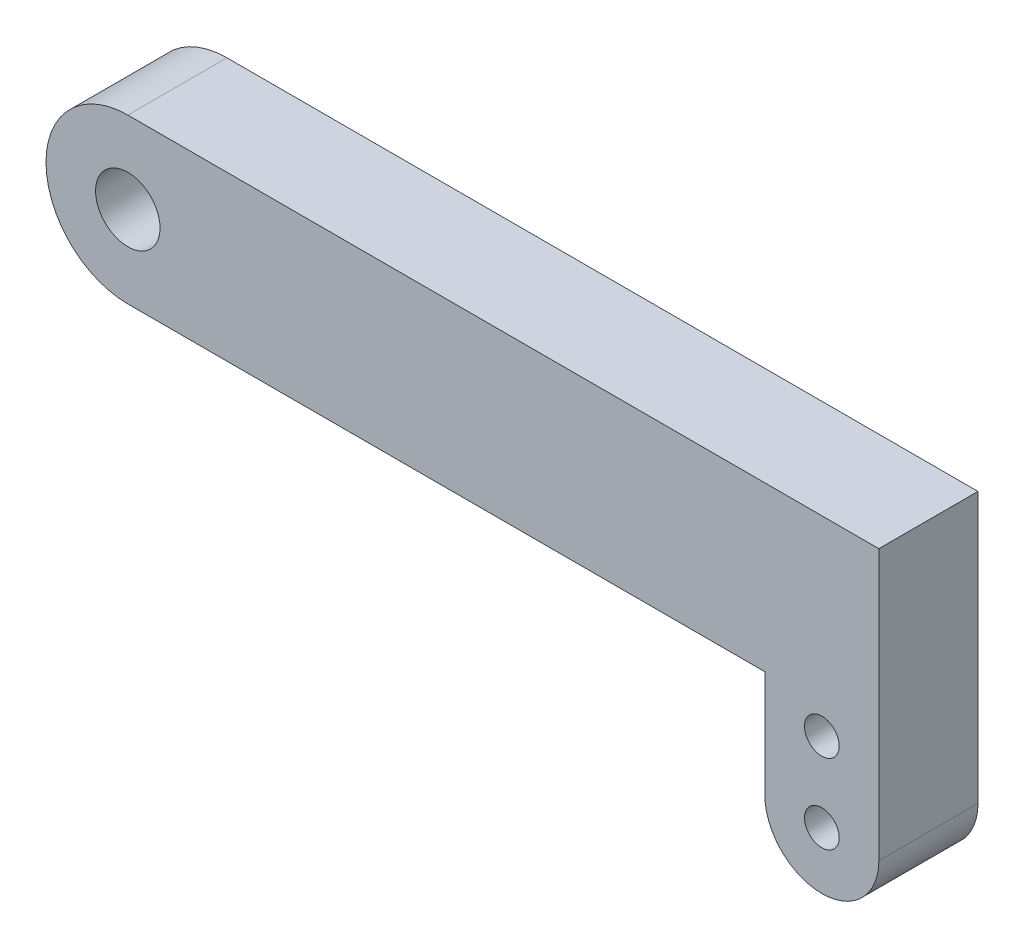
from build123d import *

# Parameters (mm, degrees)
SKETCH1_R           = 3.25
SKETCH1_R_2         = 1.75
BOSS_EXTRUDE1_DEPTH = 10


with BuildPart() as part:
    # Sketch1 → Boss-Extrude1 (new body)
    with BuildSketch(Plane.XY):
        with BuildLine():
            Line((75.75, 8.25), (0, 8.25))
            ThreePointArc((0, 8.25), (-8.25, 0), (0, -8.25))
            Line((0, -8.25), (64.25, -8.25))
            Line((64.25, -8.25), (64.25, -19))
            ThreePointArc((64.25, -19), (70, -24.75), (75.75, -19))
            Line((75.75, -19), (75.75, 8.25))
        make_face()
        Circle(SKETCH1_R, mode=Mode.SUBTRACT)
        with Locations((70, -11)):
            Circle(SKETCH1_R_2, mode=Mode.SUBTRACT)
        with Locations((70, -19)):
            Circle(SKETCH1_R_2, mode=Mode.SUBTRACT)
    extrude(amount=BOSS_EXTRUDE1_DEPTH)


solid = part.part
